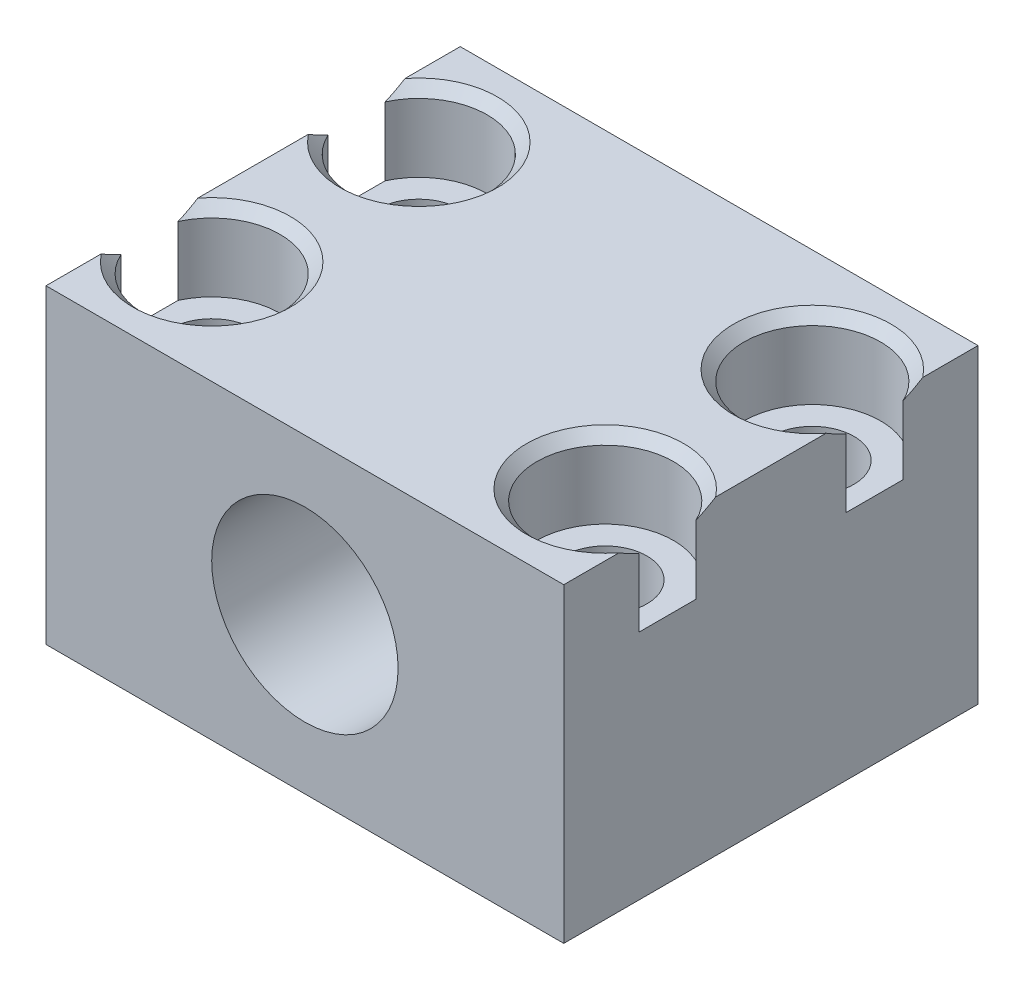
from build123d import *

# Parameters (mm, degrees)
SKETCH1_R                                    = 18.669
SKETCH1_R_2                                  = 5.715
NUT_BODY_EXTRUDE_DEPTH                       = 25.4
SKETCH2_R                                    = 18.669
SKETCH2_W                                    = 31.75
SKETCH2_H                                    = 19.05
NUT_TRIM_CUT_EXTRUDE_DEPTH                   = 37.636363384
CBORE_FOR_10_SOCKET_HEAD_CAP_SCREW1_AT_COUNT = 2
CBORE_FOR_10_SOCKET_HEAD_CAP_SCREW1_AT_PITCH = 12.7
CBORE_FOR_10_SOCKET_HEAD_CAP_SCREW1_2_COUNT  = 2
CBORE_FOR_10_SOCKET_HEAD_CAP_SCREW1_2_PITCH  = 27.268056403
CBORE_FOR_10_SOCKET_HEAD_CAP_SCREW1_3_COUNT  = 2
CBORE_FOR_10_SOCKET_HEAD_CAP_SCREW1_3_PITCH  = 24.13


with BuildPart() as part:
    # Sketch1 → nut-body-extrude (new body)
    with BuildSketch(Plane.XY):
        Circle(SKETCH1_R)
        Circle(SKETCH1_R_2, mode=Mode.SUBTRACT)
    extrude(amount=NUT_BODY_EXTRUDE_DEPTH)

    # Sketch2 → nut-trim-cut-extrude (cut, through all)
    with BuildSketch(Plane.XY):
        Circle(SKETCH2_R)
        Rectangle(SKETCH2_W, SKETCH2_H, mode=Mode.SUBTRACT)
    extrude(amount=NUT_TRIM_CUT_EXTRUDE_DEPTH, mode=Mode.SUBTRACT)

    # Sketch4 → CBORE for #10 Socket Head Cap Screw1 (revolve, cut)
    with BuildSketch(Plane(origin=(12.065, 9.525, 6.35), x_dir=(0, 0, 1), z_dir=(1, 0, 0))):
        Polygon((0, 0), (0, 19.05), (2.5527, 19.05), (2.5527, 4.826), (4.191, 4.826), (4.191, 0.635), (4.826, 0), align=None)
    cbore_for_10_socket_head_cap_screw1 = revolve(axis=Axis((12.065, 15.875, 6.35), (0, -1, 0)), mode=Mode.SUBTRACT)

    # CBORE for #10 Socket Head Cap Screw1 at: CBORE for #10 Socket Head Cap Screw1 ×2
    with Locations(*[(0, 0, i * CBORE_FOR_10_SOCKET_HEAD_CAP_SCREW1_AT_PITCH) for i in range(1, CBORE_FOR_10_SOCKET_HEAD_CAP_SCREW1_AT_COUNT)]):
        add(cbore_for_10_socket_head_cap_screw1, mode=Mode.SUBTRACT)

    # CBORE for _10 Socket Head Cap Screw1 2: CBORE for #10 Socket Head Cap Screw1 ×2
    with Locations(*[Vector(-0.8849182223819826, 0, 0.46574643283262207) * (i * CBORE_FOR_10_SOCKET_HEAD_CAP_SCREW1_2_PITCH) for i in range(1, CBORE_FOR_10_SOCKET_HEAD_CAP_SCREW1_2_COUNT)]):
        add(cbore_for_10_socket_head_cap_screw1, mode=Mode.SUBTRACT)

    # CBORE for _10 Socket Head Cap Screw1 3: CBORE for #10 Socket Head Cap Screw1 ×2
    with Locations(*[(-i * CBORE_FOR_10_SOCKET_HEAD_CAP_SCREW1_3_PITCH, 0, 0) for i in range(1, CBORE_FOR_10_SOCKET_HEAD_CAP_SCREW1_3_COUNT)]):
        add(cbore_for_10_socket_head_cap_screw1, mode=Mode.SUBTRACT)


solid = part.part
